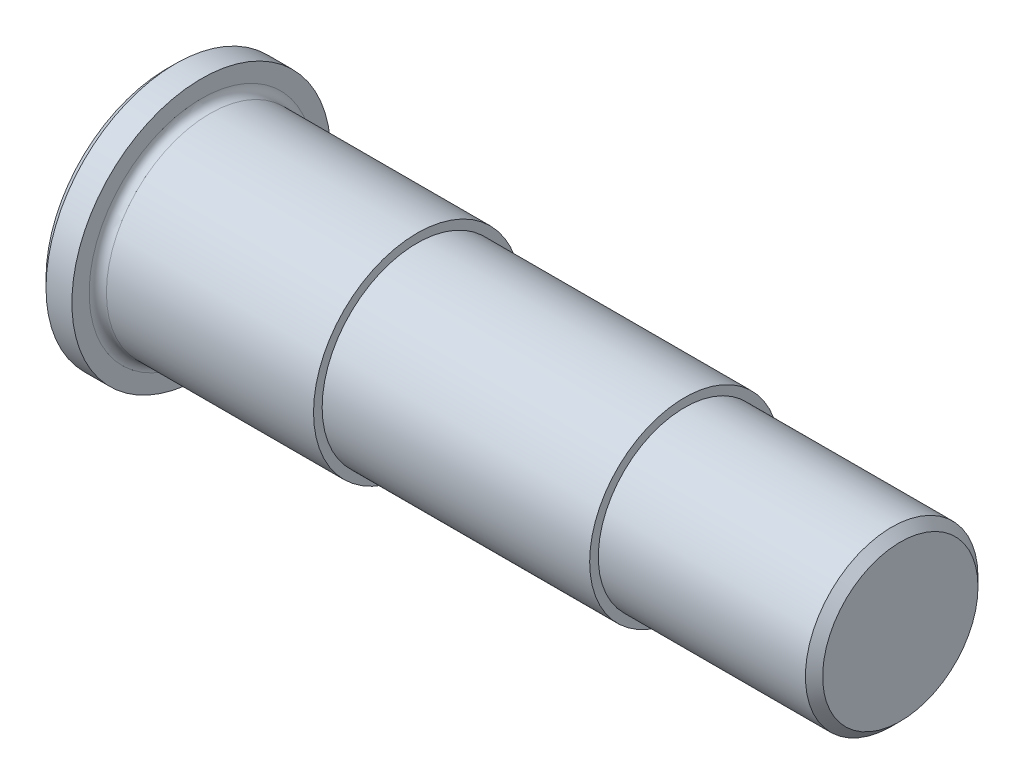
from build123d import *

# Parameters (mm, degrees)
SKETCH_1_W          = 4
SKETCH_1_H          = 15
SKETCH_2_R          = 12
EXTRUDE_1_DEPTH     = 25
SKETCH_3_R          = 11
EXTRUDE_2_DEPTH     = 31
SKETCH_4_R          = 10
EXTRUDE_3_DEPTH     = 25
CUT_EXTRUDE_1_DEPTH = 3
CHAMFER_1_SIZE      = 1
FILLET_1_R          = 1


with BuildPart() as part:
    # Эскиз1 → Повернуть1 (revolve)
    with BuildSketch(Plane.XY, mode=Mode.PRIVATE) as revolve_1_sk:
        with Locations((2, 7.5)):
            Rectangle(SKETCH_1_W, SKETCH_1_H)
    revolve(revolve_1_sk.sketch.rotate(Axis((0, 0, 0), (1, 0, 0)), 270), axis=Axis((0, 0, 0), (1, 0, 0)))

    # Эскиз2 → Бобышка-Вытянуть1 (add)
    with BuildSketch(Plane(origin=(4, 0, 0), x_dir=(0, 0, -1), z_dir=(1, 0, 0))):
        Circle(SKETCH_2_R)
    extrude(amount=EXTRUDE_1_DEPTH)

    # Эскиз3 → Бобышка-Вытянуть2 (add)
    with BuildSketch(Plane(origin=(29, 0, 0), x_dir=(0, 0, -1), z_dir=(1, 0, 0))):
        Circle(SKETCH_3_R)
    extrude(amount=EXTRUDE_2_DEPTH)

    # Эскиз4 → Бобышка-Вытянуть3 (add)
    with BuildSketch(Plane(origin=(60, 0, 0), x_dir=(0, 0, -1), z_dir=(1, 0, 0))):
        Circle(SKETCH_4_R)
    extrude(amount=EXTRUDE_3_DEPTH)

    # Эскиз5 → Вырез-Вытянуть1 (cut)
    with BuildSketch(Plane(origin=(80, 0, 0), x_dir=(0, -1, 0), z_dir=(-1, 0, 0))):
        with BuildLine():
            Line((7.141428429, -7), (-7.141428429, -7))
            ThreePointArc((-7.141428429, -7), (0, -10), (7.141428429, -7))
        make_face()
    extrude(amount=-CUT_EXTRUDE_1_DEPTH, mode=Mode.SUBTRACT)

    # Фаска1
    chamfer_1_edges = [part.edges().sort_by_distance(p)[0] for p in [
        (85, 0, 10),
        (0, 0, 15),
    ]]
    chamfer(chamfer_1_edges, length=CHAMFER_1_SIZE)

    # Скругление1
    fillet_1_edges = [part.edges().sort_by_distance(p)[0] for p in [
        (4, 0, 12),
    ]]
    fillet(fillet_1_edges, radius=FILLET_1_R)


solid = part.part
